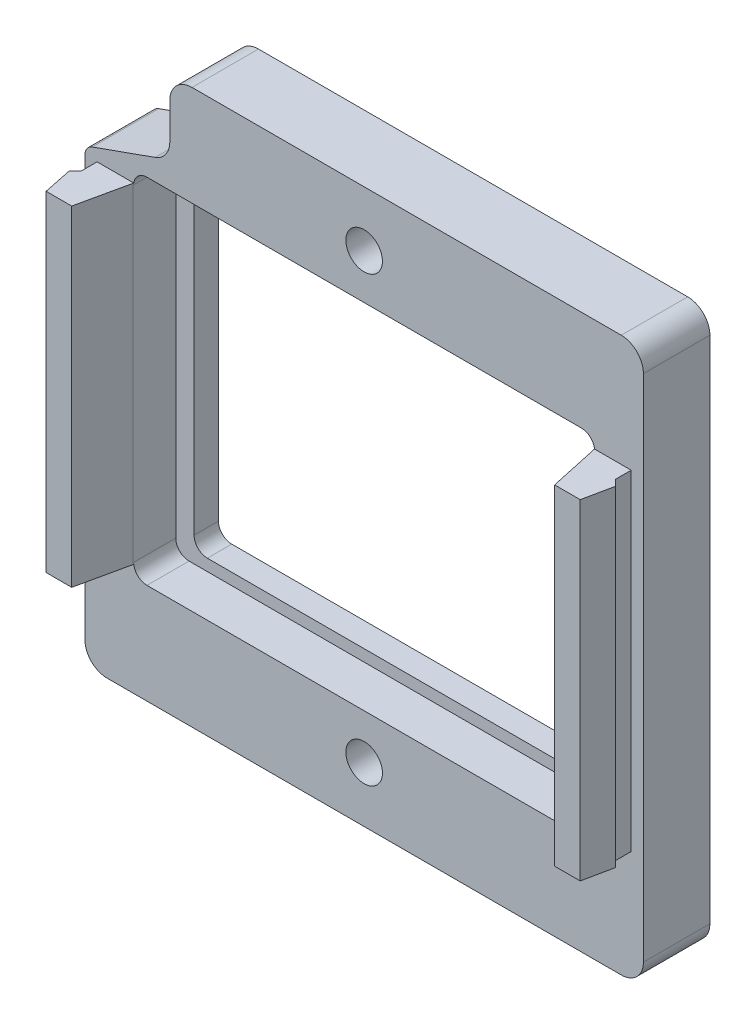
from build123d import *

# Parameters (mm, degrees)
SKETCH1_R           = 1.65
BOSS_EXTRUDE1_DEPTH = 10.6
SKETCH2_OUTSIDE_W   = 66.756
SKETCH2_OUTSIDE_H   = 66.356
SKETCH2_OUTSIDE_W_2 = 50.4
SKETCH2_OUTSIDE_H_2 = 29.8
CUT_EXTRUDE1_DEPTH  = 4.6
CUT_EXTRUDE2_DEPTH  = 8.4
SKETCH4_OUTSIDE_W   = 66.756
SKETCH4_OUTSIDE_H   = 26.956
CUT_EXTRUDE3_DEPTH  = 50


with BuildPart() as part:
    # Sketch1 → Boss-Extrude1 (new body)
    with BuildSketch(Plane.XY):
        with BuildLine():
            Line((-17.536336397, 19.751180304), (-17.536336397, 23))
            ThreePointArc((-17.536336397, 23), (-16.950549959, 24.414213562), (-15.536336397, 25))
            Line((-15.536336397, 25), (23.2, 25))
            ThreePointArc((23.2, 25), (24.614213562, 24.414213562), (25.2, 23))
            Line((25.2, 23), (25.2, -23))
            ThreePointArc((25.2, -23), (24.614213562, -24.414213562), (23.2, -25))
            Line((23.2, -25), (-23.2, -25))
            ThreePointArc((-23.2, -25), (-24.614213562, -24.414213562), (-25.2, -23))
            Line((-25.2, -23), (-25.2, 14.9))
            ThreePointArc((-25.2, 14.9), (-25.01741556, 15.476048437), (-24.536336397, 15.841741912))
            Line((-24.536336397, 15.841741912), (-18.863663603, 17.867696481))
            ThreePointArc((-18.863663603, 17.867696481), (-17.901505276, 18.599083431), (-17.536336397, 19.751180304))
        make_face()
        with Locations((0, 20)):
            Circle(SKETCH1_R, mode=Mode.SUBTRACT)
        with Locations((0, -20)):
            Circle(SKETCH1_R, mode=Mode.SUBTRACT)
        with BuildLine():
            Line((-19.15, -13.7), (-19.15, 13.7))
            ThreePointArc((-19.15, 13.7), (-18.798528137, 14.548528137), (-17.95, 14.9))
            Line((-17.95, 14.9), (17.95, 14.9))
            ThreePointArc((17.95, 14.9), (18.798528137, 14.548528137), (19.15, 13.7))
            Line((19.15, 13.7), (19.15, -13.7))
            ThreePointArc((19.15, -13.7), (18.798528137, -14.548528137), (17.95, -14.9))
            Line((17.95, -14.9), (-17.95, -14.9))
            ThreePointArc((-17.95, -14.9), (-18.798528137, -14.548528137), (-19.15, -13.7))
        make_face(mode=Mode.SUBTRACT)
    extrude(amount=BOSS_EXTRUDE1_DEPTH)

    # Sketch2 outside → Cut-Extrude1 (cut)
    with BuildSketch(Plane.XY.offset(10.6)):
        Rectangle(SKETCH2_OUTSIDE_W, SKETCH2_OUTSIDE_H)
        Rectangle(SKETCH2_OUTSIDE_W_2, SKETCH2_OUTSIDE_H_2, mode=Mode.SUBTRACT)
    extrude(amount=-CUT_EXTRUDE1_DEPTH, mode=Mode.SUBTRACT)

    # Sketch3 → Cut-Extrude2 (cut)
    with BuildSketch(Plane.XY.offset(10.6)):
        with BuildLine():
            Line((-20.8, -14.75), (-20.8, 14.75))
            ThreePointArc((-20.8, 14.75), (-20.448528137, 15.598528137), (-19.6, 15.95))
            Line((-19.6, 15.95), (19.6, 15.95))
            ThreePointArc((19.6, 15.95), (20.448528137, 15.598528137), (20.8, 14.75))
            Line((20.8, 14.75), (20.8, -14.75))
            ThreePointArc((20.8, -14.75), (20.448528137, -15.598528137), (19.6, -15.95))
            Line((19.6, -15.95), (-19.6, -15.95))
            ThreePointArc((-19.6, -15.95), (-20.448528137, -15.598528137), (-20.8, -14.75))
        make_face()
    extrude(amount=-CUT_EXTRUDE2_DEPTH, mode=Mode.SUBTRACT)

    # Sketch4 outside → Cut-Extrude3 (cut)
    with BuildSketch(Plane.XZ.offset(25)):
        with Locations((0, 5.3)):
            Rectangle(SKETCH4_OUTSIDE_W, SKETCH4_OUTSIDE_H)
        Polygon((-24.1, 7.4), (-24.65, 7.95), (-24.1, 10.6), (-21.79058809, 10.6), (-20.79058809, 6), (20.79058809, 6), (21.79058809, 10.6), (24.1, 10.6), (24.65, 7.95), (24.1, 7.4), (24.1, 6), (25.2, 6), (25.2, 0), (-25.2, 0), (-25.2, 6), (-24.1, 6), align=None, mode=Mode.SUBTRACT)
    extrude(amount=-CUT_EXTRUDE3_DEPTH, mode=Mode.SUBTRACT)


solid = part.part
